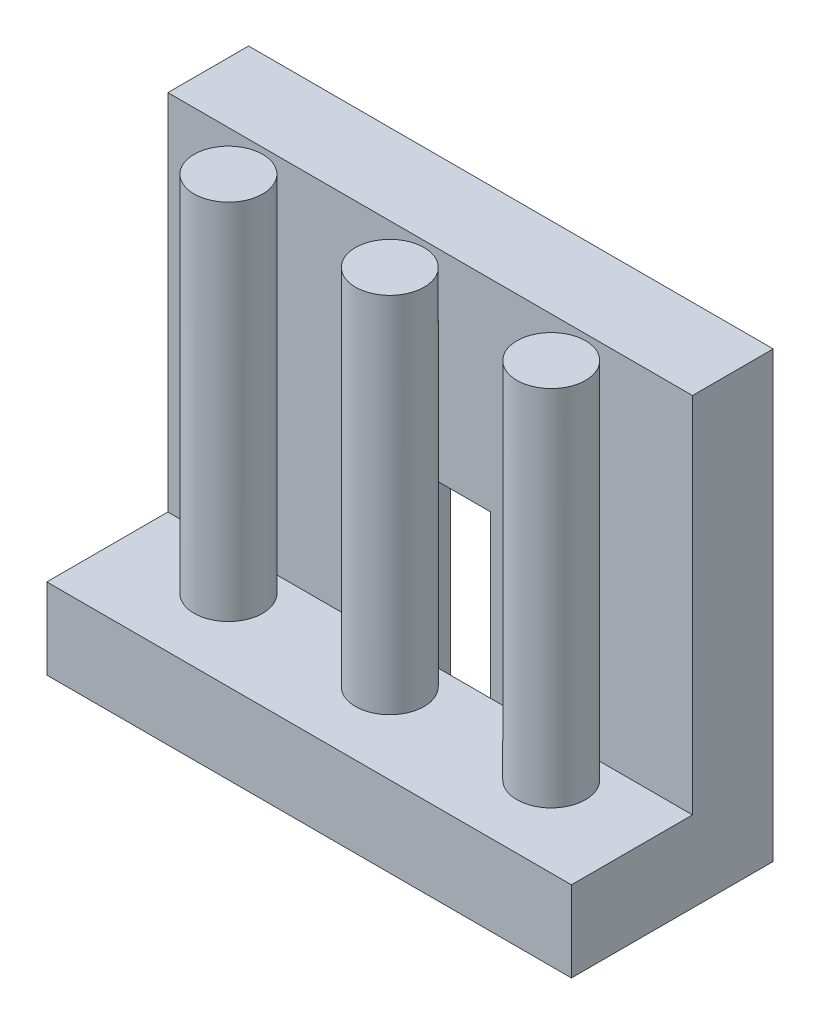
from build123d import *

# Parameters (mm, degrees)
SKETCH1_W           = 13
SKETCH1_H           = 5
BOSS_EXTRUDE1_DEPTH = 11
SKETCH2_W           = 13
SKETCH2_H           = 3
CUT_EXTRUDE1_DEPTH  = 9
SKETCH3_W           = 3
SKETCH3_H           = 6
CUT_EXTRUDE2_DEPTH  = 2
SKETCH4_R           = 0.85
BOSS_EXTRUDE3_DEPTH = 9


with BuildPart() as part:
    # Sketch1 → Boss-Extrude1 (new body)
    with BuildSketch(Plane(origin=(0, 0, 0), x_dir=(1, 0, 0), z_dir=(0, 1, 0))):
        with Locations((6.5, 2.5)):
            Rectangle(SKETCH1_W, SKETCH1_H)
    extrude(amount=BOSS_EXTRUDE1_DEPTH)

    # Sketch2 → Cut-Extrude1 (cut)
    with BuildSketch(Plane(origin=(0, 11, 0), x_dir=(1, 0, 0), z_dir=(0, 1, 0))):
        with Locations((6.5, 1.5)):
            Rectangle(SKETCH2_W, SKETCH2_H)
    extrude(amount=-CUT_EXTRUDE1_DEPTH, mode=Mode.SUBTRACT)

    # Sketch3 → Cut-Extrude2 (cut)
    with BuildSketch(Plane(origin=(0, 0, -5), x_dir=(-1, 0, 0), z_dir=(0, 0, -1))):
        with Locations((-6.5, 3)):
            Rectangle(SKETCH3_W, SKETCH3_H)
    extrude(amount=-CUT_EXTRUDE2_DEPTH, mode=Mode.SUBTRACT)

    # Sketch4 → Boss-Extrude3 (add)
    with BuildSketch(Plane(origin=(0, 2, 0), x_dir=(1, 0, 0), z_dir=(0, 1, 0))):
        with Locations(Location((10.5, 2, 0), (0, 0, 90))):
            Circle(SKETCH4_R)
        with Locations(Location((6.5, 2, 0), (0, 0, 90))):
            Circle(SKETCH4_R)
        with Locations(Location((2.5, 2, 0), (0, 0, 90))):
            Circle(SKETCH4_R)
    extrude(amount=BOSS_EXTRUDE3_DEPTH)


solid = part.part
